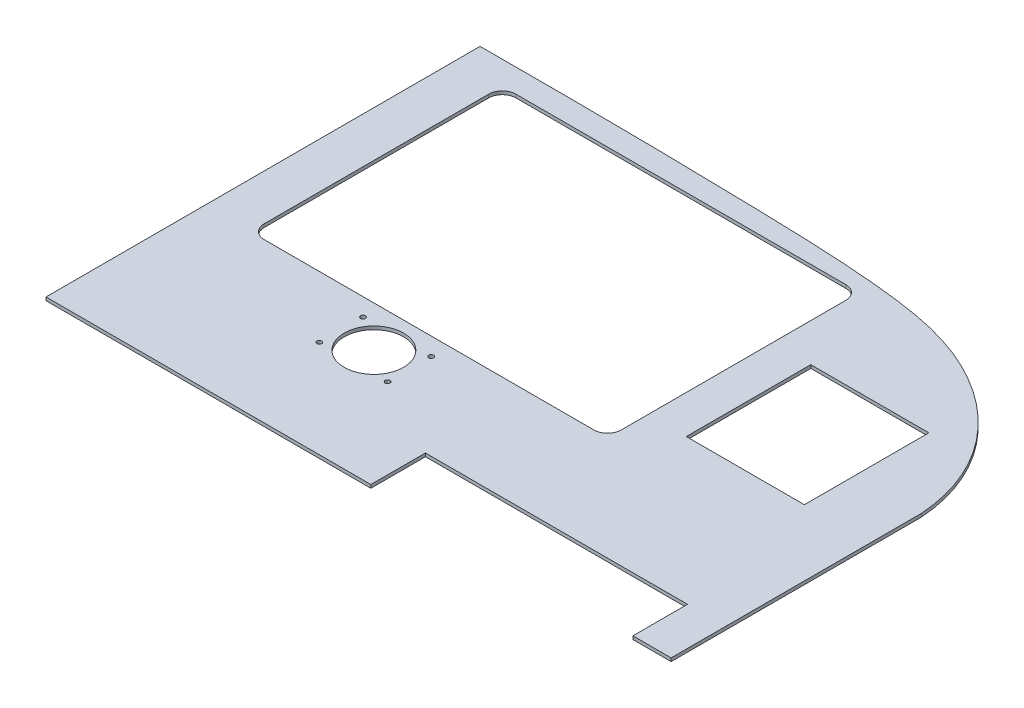
from build123d import *

# Parameters (mm, degrees)
CROQUIS3_R              = 21.75
CROQUIS3_R_2            = 1.75
CROQUIS3_W              = 86.5
CROQUIS3_H              = 91.2
SALIENTE_EXTRUIR1_DEPTH = 2.4


with BuildPart() as part:
    # Croquis3 → Saliente-Extruir1 (new body)
    with BuildSketch(Plane(origin=(0, 0, 0), x_dir=(1, 0, 0), z_dir=(0, 1, 0))):
        with BuildLine():
            Line((462.055943971, -126.244094236), (270.055943971, -126.244094236))
            Line((270.055943971, -126.244094236), (270.055943971, -166.244094236))
            Line((270.055943971, -166.244094236), (32.055943971, -166.244094236))
            Line((32.055943971, -166.244094236), (32.055943971, 151.755905764))
            add(Edge.make_bspline(
                [(32.055943971, 151.755905764), (102.52055172, 152.083892996), (202.389819544, 151.163122701), (322.889642457, 147.223796339), (425.617825051, 131.81341345), (485.96008446, 74.272558466), (490.055943971, 17.159454913)],
                knots=[0, 0, 0, 0, 0.404967978, 0.578404141, 0.696078676, 1, 1, 1, 1], degree=3))
            Line((490.055943971, 17.159454913), (490.055943971, -126.244094236))
            Line((490.055943971, -126.244094236), (490.055943971, -166.244094236))
            Line((490.055943971, -166.244094236), (462.055943971, -166.244094236))
            Line((462.055943971, -166.244094236), (462.055943971, -126.244094236))
        make_face()
        with Locations(Location((185.955943971, -79.918767417, 0), (0, 0, 270))):
            Circle(CROQUIS3_R, mode=Mode.SUBTRACT)
        with Locations(Location((160.955943971, -62.918767417, 0), (0, 0, 270))):
            Circle(CROQUIS3_R_2, mode=Mode.SUBTRACT)
        with Locations(Location((210.955943971, -62.918767417, 0), (0, 0, 270))):
            Circle(CROQUIS3_R_2, mode=Mode.SUBTRACT)
        with Locations(Location((210.955943971, -94.918767417, 0), (0, 0, 270))):
            Circle(CROQUIS3_R_2, mode=Mode.SUBTRACT)
        with Locations(Location((160.955943971, -94.918767417, 0), (0, 0, 270))):
            Circle(CROQUIS3_R_2, mode=Mode.SUBTRACT)
        with BuildLine():
            Line((75.555943971, 134.581232583), (317.183594896, 134.581232583))
            ThreePointArc((317.183594896, 134.581232583), (324.254662708, 131.652300395), (327.183594896, 124.581232583))
            Line((327.183594896, 124.581232583), (327.183594896, -39.918767417))
            ThreePointArc((327.183594896, -39.918767417), (324.254662708, -46.989835229), (317.183594896, -49.918767417))
            Line((317.183594896, -49.918767417), (75.555943971, -49.918767417))
            ThreePointArc((75.555943971, -49.918767417), (68.484876159, -46.989835229), (65.555943971, -39.918767417))
            Line((65.555943971, -39.918767417), (65.555943971, 124.581232583))
            ThreePointArc((65.555943971, 124.581232583), (68.484876159, 131.652300395), (75.555943971, 134.581232583))
        make_face(mode=Mode.SUBTRACT)
        with Locations((398.433594896, 25.355905764)):
            Rectangle(CROQUIS3_W, CROQUIS3_H, mode=Mode.SUBTRACT)
    extrude(amount=SALIENTE_EXTRUIR1_DEPTH)


solid = part.part
